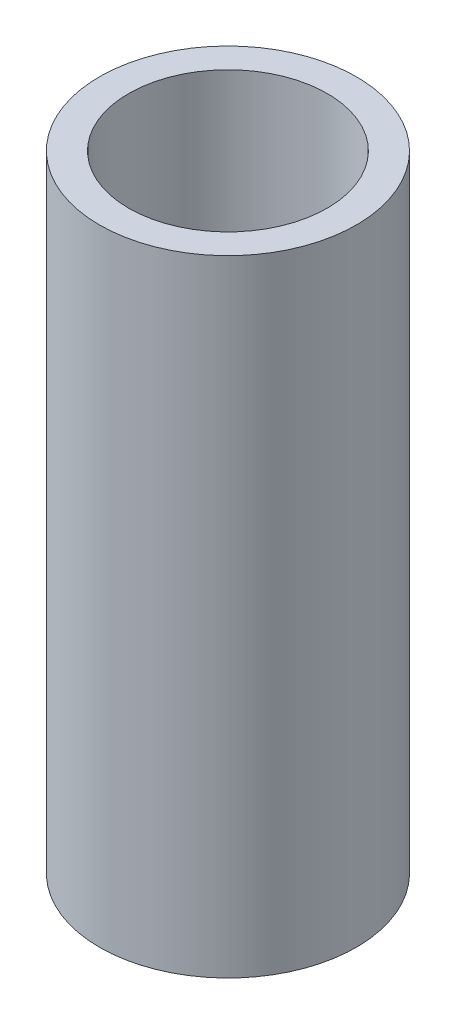
from build123d import *

# Parameters (mm, degrees)
BOSS_EXTRUDE1_DEPTH      = 21.9964
BOSS_EXTRUDE1_DEPTH_BACK = 3
SKETCH1_R                = 5.1308
SKETCH2_R                = 3.96875
CUT_EXTRUDE1_DEPTH       = 40


with BuildPart() as part:
    # Sketch1 → Boss-Extrude1 (new, two sides: drawn at the far end of the back side and taken through both)
    with BuildSketch(Plane(origin=(0.121948519, -10.884167759, 6.400144961), x_dir=(1, 0, 0), z_dir=(0, 1, 0)).offset(-BOSS_EXTRUDE1_DEPTH_BACK)):
        with Locations(Location((-0.121948519, 6.400144961, 0), (0, 0, 270))):
            Circle(SKETCH1_R)
    extrude(amount=BOSS_EXTRUDE1_DEPTH + BOSS_EXTRUDE1_DEPTH_BACK)

    # Sketch2 → Cut-Extrude1 (cut)
    with BuildSketch(Plane(origin=(0, 11.112232241, 0), x_dir=(1, 0, 0), z_dir=(0, 1, 0))):
        with Locations(Location((0, 0, 0), (0, 0, 270))):
            Circle(SKETCH2_R)
    extrude(amount=-CUT_EXTRUDE1_DEPTH, mode=Mode.SUBTRACT)


solid = part.part
